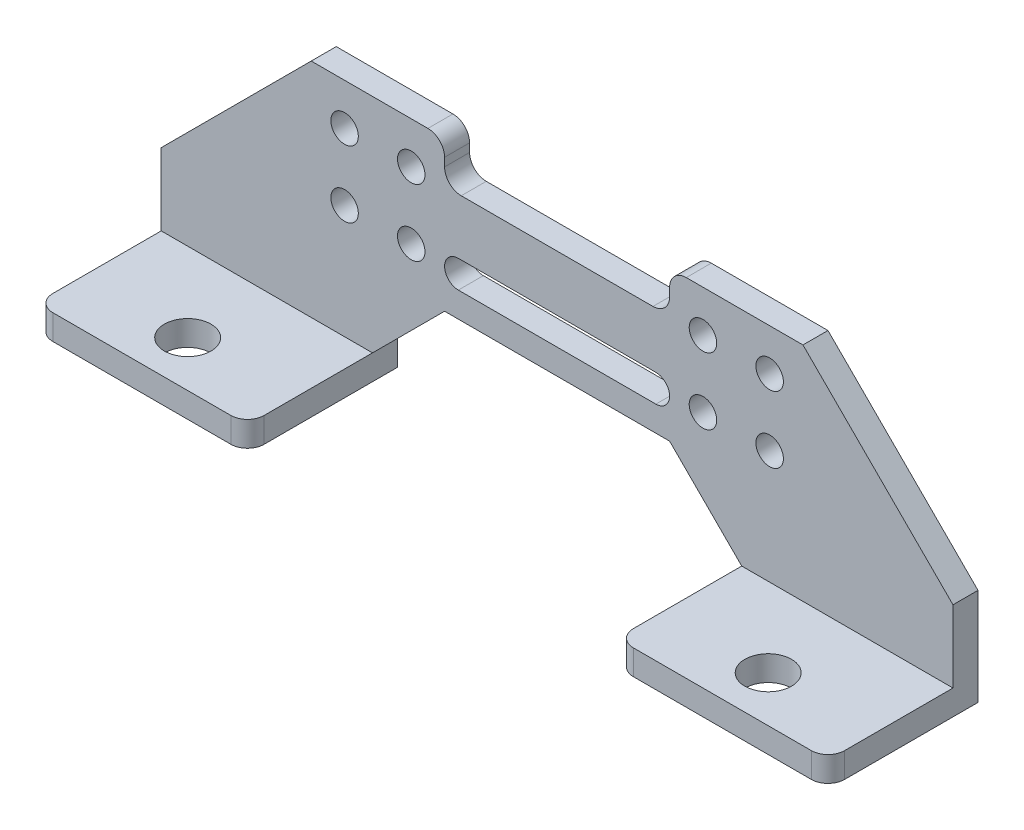
from build123d import *

# Parameters (mm, degrees)
SKETCH_1_R          = 1.65
EXTRUDE_1_DEPTH     = 3
SKETCH_4_W          = 25.35
SKETCH_4_H          = 3
EXTRUDE_3_DEPTH     = 18
SKETCH_5_R          = 2.8
CUT_EXTRUDE_2_DEPTH = 18
FILLET_2_R          = 2


with BuildPart() as part:
    # 草图1 → 凸台-拉伸1 (new body)
    with BuildSketch(Plane.XY):
        Polygon((3.35, -13.65), (12, -5), (39, -5), (47.65, -13.65), (73, -13.65), (73, -5), (55, 13), (39, 13), (39, 8), (12, 8), (12, 13), (-4, 13), (-22, -5), (-22, -13.65), align=None)
        Circle(SKETCH_1_R, mode=Mode.SUBTRACT)
        with Locations((8, 0)):
            Circle(SKETCH_1_R, mode=Mode.SUBTRACT)
        with BuildLine():
            ThreePointArc((13.65, -1.975), (12, -0.325), (13.65, 1.325))
            Line((13.65, 1.325), (37.35, 1.325))
            ThreePointArc((37.35, 1.325), (39, -0.325), (37.35, -1.975))
            Line((37.35, -1.975), (13.65, -1.975))
        make_face(mode=Mode.SUBTRACT)
        with Locations((43, 0)):
            Circle(SKETCH_1_R, mode=Mode.SUBTRACT)
        with Locations((51, 0)):
            Circle(SKETCH_1_R, mode=Mode.SUBTRACT)
        with Locations((0, 8)):
            Circle(SKETCH_1_R, mode=Mode.SUBTRACT)
        with BuildLine():
            ThreePointArc((8, 6.35), (6.833273811, 9.166726189), (9.65, 8))
            ThreePointArc((9.65, 8), (9.166726189, 6.833273811), (8, 6.35))
        make_face(mode=Mode.SUBTRACT)
        with BuildLine():
            ThreePointArc((43, 6.35), (41.833273811, 6.833273811), (41.35, 8))
            ThreePointArc((41.35, 8), (44.166726189, 9.166726189), (43, 6.35))
        make_face(mode=Mode.SUBTRACT)
        with Locations((51, 8)):
            Circle(SKETCH_1_R, mode=Mode.SUBTRACT)
    extrude(amount=EXTRUDE_1_DEPTH)

    # 草图4 → 凸台-拉伸3 (add)
    with BuildSketch(Plane.XY):
        with Locations((-9.325, -15.15)):
            Rectangle(SKETCH_4_W, SKETCH_4_H)
        with Locations((60.325, -15.15)):
            Rectangle(SKETCH_4_W, SKETCH_4_H)
    extrude(amount=EXTRUDE_3_DEPTH)

    # 草图5 → 切除-拉伸2 (cut)
    with BuildSketch(Plane.XZ.offset(16.65)):
        with Locations(Location((60.325, 12.5, 0), (0, 0, 270))):
            Circle(SKETCH_5_R)
        with Locations(Location((-9.325, 12.5, 0), (0, 0, 270))):
            Circle(SKETCH_5_R)
    extrude(amount=-CUT_EXTRUDE_2_DEPTH, mode=Mode.SUBTRACT)

    # 圆角2
    fillet_2_edges = [part.edges().sort_by_distance(p)[0] for p in [
        (39, 13, 1.5),
        (12, 13, 1.5),
        (12, 8, 1.5),
        (39, 8, 1.5),
        (-22, -15.15, 18),
        (3.35, -15.15, 18),
        (47.65, -15.15, 18),
        (73, -15.15, 18),
    ]]
    fillet(fillet_2_edges, radius=FILLET_2_R)


solid = part.part
